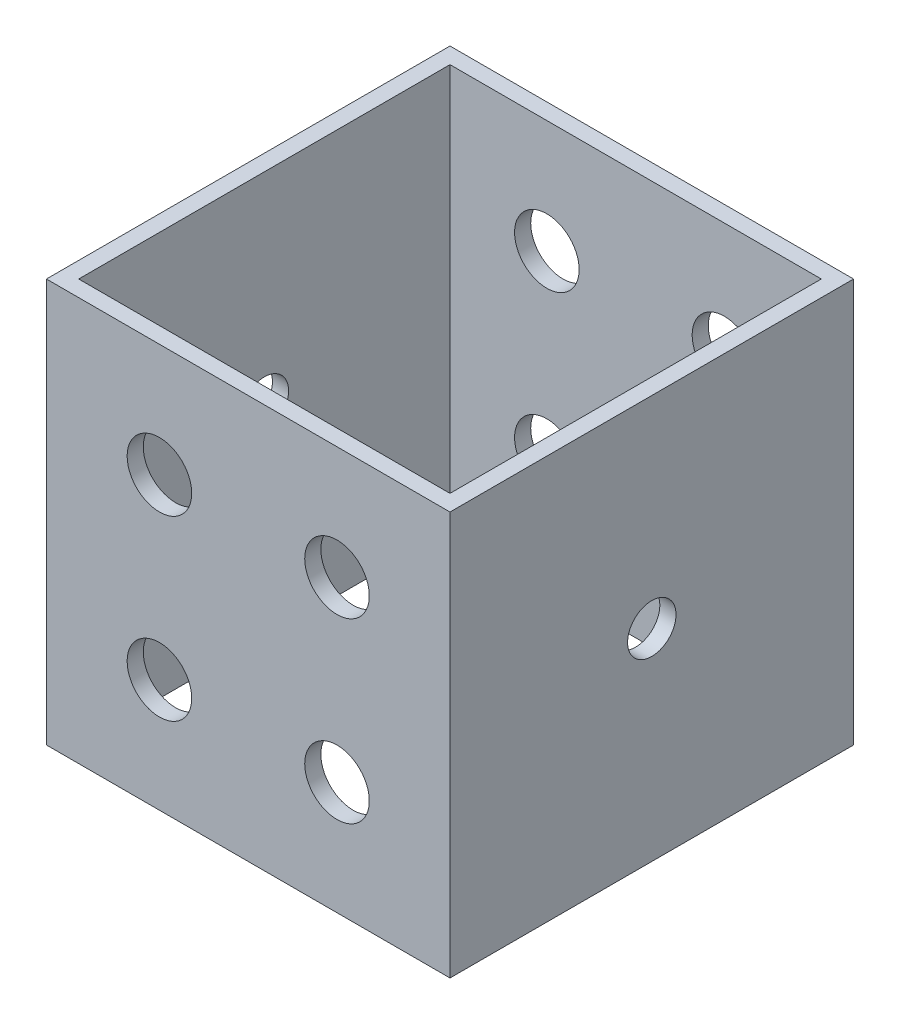
from build123d import *

# Parameters (mm, degrees)
BOSS_EXTRUDE1_DEPTH      = 12.5
BOSS_EXTRUDE1_DEPTH_BACK = 12.5
SKETCH1_W                = 25
SKETCH1_H                = 25
SKETCH1_W_2              = 23
SKETCH1_H_2              = 23
SKETCH2_R                = 2
CUT_EXTRUDE1_DEPTH       = 25
SKETCH3_R                = 1.5
CUT_EXTRUDE2_DEPTH       = 25


with BuildPart() as part:
    # Sketch1 → Boss-Extrude1 (new, two sides: drawn at the far end of the back side and taken through both)
    with BuildSketch(Plane(origin=(0, 0, 0), x_dir=(1, 0, 0), z_dir=(0, 1, 0)).offset(-BOSS_EXTRUDE1_DEPTH_BACK)):
        Rectangle(SKETCH1_W, SKETCH1_H)
        Rectangle(SKETCH1_W_2, SKETCH1_H_2, mode=Mode.SUBTRACT)
    extrude(amount=BOSS_EXTRUDE1_DEPTH + BOSS_EXTRUDE1_DEPTH_BACK)

    # Sketch2 → Cut-Extrude1 (cut)
    with BuildSketch(Plane(origin=(0, 0, -12.5), x_dir=(-1, 0, 0), z_dir=(0, 0, -1))):
        with Locations((5.5, 5.5)):
            Circle(SKETCH2_R)
        with Locations((5.5, -5.5)):
            Circle(SKETCH2_R)
        with Locations((-5.5, -5.5)):
            Circle(SKETCH2_R)
        with Locations((-5.5, 5.5)):
            Circle(SKETCH2_R)
    extrude(amount=-CUT_EXTRUDE1_DEPTH, mode=Mode.SUBTRACT)

    # Sketch3 → Cut-Extrude2 (cut)
    with BuildSketch(Plane(origin=(12.5, 0, 0), x_dir=(0, 0, -1), z_dir=(1, 0, 0))):
        Circle(SKETCH3_R)
    extrude(amount=-CUT_EXTRUDE2_DEPTH, mode=Mode.SUBTRACT)


solid = part.part
